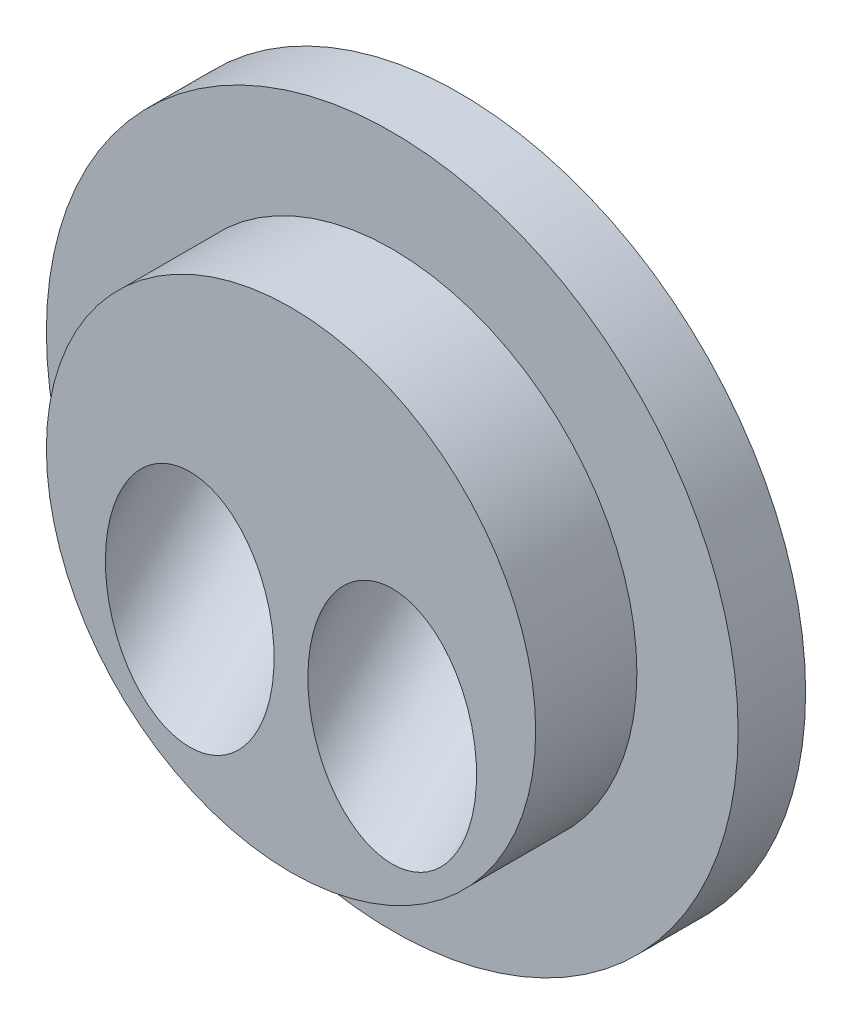
from build123d import *

# Parameters (mm, degrees)
OUTER_SKETCH_R                = 10.25
OUTER_DEPTH                   = 2
INNER_SKETCH_R                = 7.25
INNER_DEPTH                   = 3
ODEBRAT_VYSUNUT_M2_DEPTH      = 15.746272134
ODEBRAT_VYSUNUT_M2_DEPTH_BACK = 15.746272134
SKICA8_R                      = 2.5


with BuildPart() as part:
    # Outer sketch → Outer (new body)
    with BuildSketch(Plane.XY):
        Circle(OUTER_SKETCH_R)
    extrude(amount=OUTER_DEPTH)

    # Inner sketch → Inner (add)
    with BuildSketch(Plane.XY.offset(2)):
        Circle(INNER_SKETCH_R)
    extrude(amount=INNER_DEPTH)

    # Skica8 → Odebrat vysunutím2 (cut, two sides: drawn at the far end of the back side and taken through both)
    with BuildSketch(Plane(origin=(0, -0.042117416, 2.457882584), x_dir=(1, 0, 0), z_dir=(0, -0.7071067811865476, 0.7071067811865476)).offset(-ODEBRAT_VYSUNUT_M2_DEPTH_BACK)):
        with Locations(Location((-3, 0.413116411, 0), (0, 0, 270))):
            Circle(SKICA8_R)
        with Locations(Location((3, 0.413116411, 0), (0, 0, 270))):
            Circle(SKICA8_R)
    extrude(amount=ODEBRAT_VYSUNUT_M2_DEPTH + ODEBRAT_VYSUNUT_M2_DEPTH_BACK, mode=Mode.SUBTRACT)


solid = part.part
